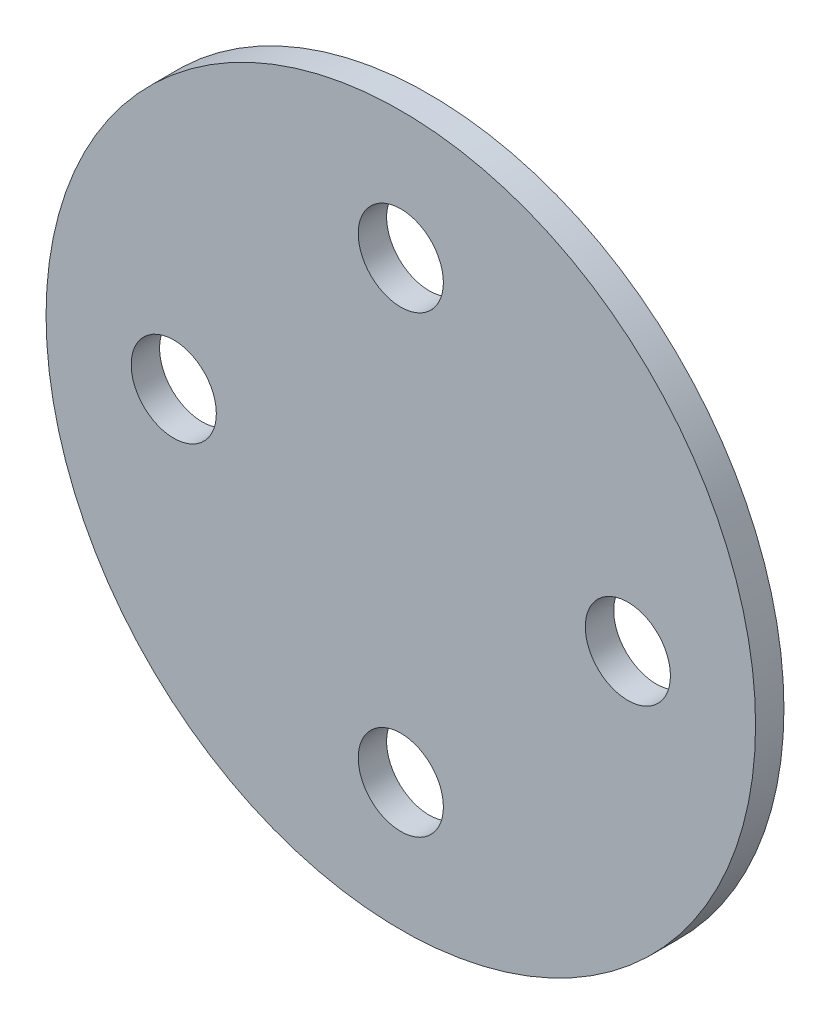
from build123d import *

# Parameters (mm, degrees)
SKIZZE1_R                       = 12.5
SKIZZE1_R_2                     = 1.5
AUFSATZ_LINEAR_AUSTRAGEN1_DEPTH = 1


with BuildPart() as part:
    # Skizze1 → Aufsatz-Linear austragen1 (new body)
    with BuildSketch(Plane.XY):
        Circle(SKIZZE1_R)
        with Locations((8, 0)):
            Circle(SKIZZE1_R_2, mode=Mode.SUBTRACT)
        with Locations((0, -8)):
            Circle(SKIZZE1_R_2, mode=Mode.SUBTRACT)
        with Locations((-8, 0)):
            Circle(SKIZZE1_R_2, mode=Mode.SUBTRACT)
        with Locations((0, 8)):
            Circle(SKIZZE1_R_2, mode=Mode.SUBTRACT)
    extrude(amount=AUFSATZ_LINEAR_AUSTRAGEN1_DEPTH)


solid = part.part
